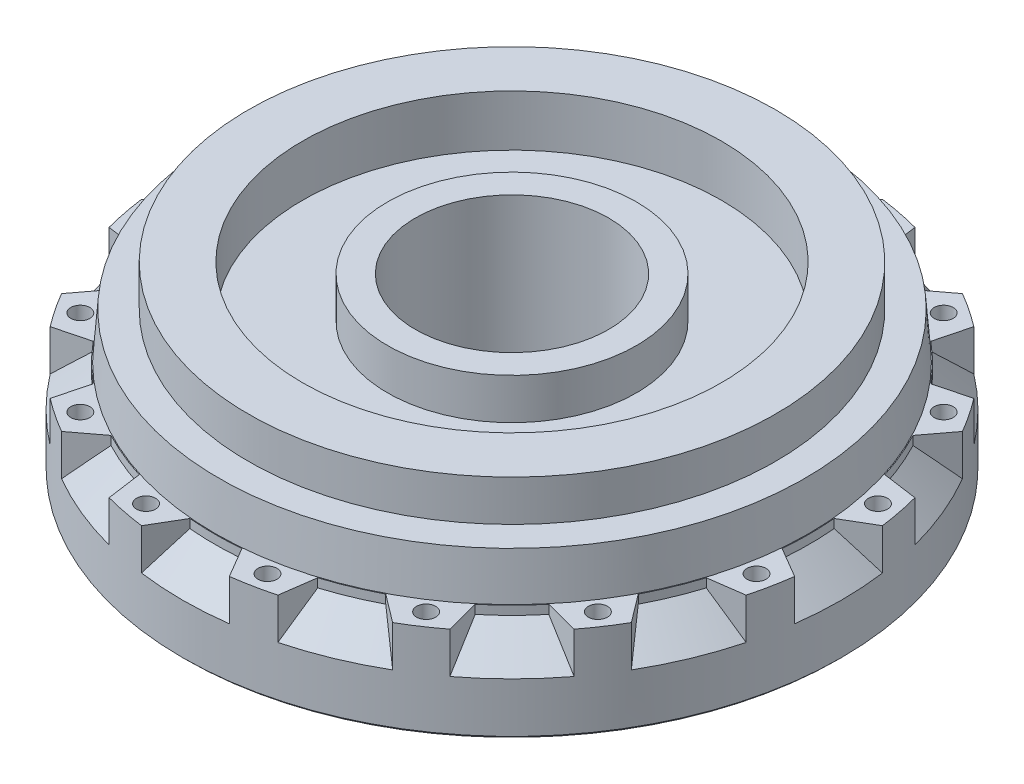
from build123d import *

# Parameters (mm, degrees)
CUT_EXTRUDE1_DEPTH = 28
CIRPATTERN1_COUNT  = 16
SKETCH5_R          = 6.5
CUT_EXTRUDE2_DEPTH = 336.079515181
CHAMFER1_SIZE      = 2


with BuildPart() as part:
    # Sketch1 → Revolve1 (revolve)
    with BuildSketch(Plane.XY, mode=Mode.PRIVATE) as revolve1_sk:
        Polygon((225, 0), (225, 64), (202.5, 64), (200, 95.5), (180, 95.5), (180, 123.5), (143, 123.5), (143, 88.5), (85, 88.5), (85, 116.5), (66, 116.5), (66, -41.015625), (86.5078125, -41.015625), (86.5078125, 0), align=None)
    revolve(revolve1_sk.sketch.rotate(Axis((0, 0, 0), (0, 1, 0)), 90), axis=Axis((0, 0, 0), (0, 1, 0)))

    # Sketch3 → Cut-Extrude1 (cut)
    with BuildSketch(Plane(origin=(0, 64, 0), x_dir=(1, 0, 0), z_dir=(0, 1, 0))):
        with BuildLine():
            Line((222.99103121, 30), (201.742410018, 17.5))
            ThreePointArc((201.742410018, 17.5), (202.5, 0), (201.742410018, -17.5))
            Line((201.742410018, -17.5), (222.99103121, -30))
            ThreePointArc((222.99103121, -30), (225, 0), (222.99103121, 30))
        make_face()
    cut_extrude1 = extrude(amount=-CUT_EXTRUDE1_DEPTH, mode=Mode.SUBTRACT)

    # CirPattern1: Cut-Extrude1 ×16 about axis
    cirpattern1_axis = Axis((0, 0, 0), (0, 1, 0))
    for i in range(1, CIRPATTERN1_COUNT):
        add(cut_extrude1.rotate(cirpattern1_axis, i * 360 / CIRPATTERN1_COUNT), mode=Mode.SUBTRACT)

    # Sketch4 → Revolve2 (revolve)
    with BuildSketch(Plane.XY):
        Polygon((225, 36), (203, 58), (203, 64), (195, 64), (195, 0), (225, 0), align=None)
    revolve(axis=Axis((0, 0, 0), (0, 1, 0)))

    # Sketch5 → Cut-Extrude2 (cut, through all)
    with BuildSketch(Plane(origin=(0, 64, 0), x_dir=(1, 0, 0), z_dir=(0, 1, 0))):
        with Locations(Location((208.416872086, 41.456693428, 0), (0, 0, 270))):
            Circle(SKETCH5_R)
        with Locations(Location((208.416872086, -41.456693428, 0), (0, 0, 270))):
            Circle(SKETCH5_R)
        with Locations(Location((176.687292614, -118.058674517, 0), (0, 0, 270))):
            Circle(SKETCH5_R)
        with Locations(Location((118.058674517, -176.687292614, 0), (0, 0, 270))):
            Circle(SKETCH5_R)
        with Locations(Location((41.456693428, -208.416872086, 0), (0, 0, 270))):
            Circle(SKETCH5_R)
        with Locations(Location((-41.456693428, -208.416872086, 0), (0, 0, 270))):
            Circle(SKETCH5_R)
        with Locations(Location((-118.058674517, -176.687292614, 0), (0, 0, 270))):
            Circle(SKETCH5_R)
        with Locations(Location((-176.687292614, -118.058674517, 0), (0, 0, 270))):
            Circle(SKETCH5_R)
        with Locations(Location((-208.416872086, -41.456693428, 0), (0, 0, 270))):
            Circle(SKETCH5_R)
        with Locations(Location((-208.416872086, 41.456693428, 0), (0, 0, 270))):
            Circle(SKETCH5_R)
        with Locations(Location((-176.687292614, 118.058674517, 0), (0, 0, 270))):
            Circle(SKETCH5_R)
        with Locations(Location((-118.058674517, 176.687292614, 0), (0, 0, 270))):
            Circle(SKETCH5_R)
        with Locations(Location((-41.456693428, 208.416872086, 0), (0, 0, 270))):
            Circle(SKETCH5_R)
        with Locations(Location((41.456693428, 208.416872086, 0), (0, 0, 270))):
            Circle(SKETCH5_R)
        with Locations(Location((118.058674517, 176.687292614, 0), (0, 0, 270))):
            Circle(SKETCH5_R)
        with Locations(Location((176.687292614, 118.058674517, 0), (0, 0, 270))):
            Circle(SKETCH5_R)
    extrude(amount=-CUT_EXTRUDE2_DEPTH, mode=Mode.SUBTRACT)

    # Chamfer1
    chamfer1_edges = [part.edges().sort_by_distance(p)[0] for p in [
        (0, 0, 225),
    ]]
    chamfer(chamfer1_edges, length=CHAMFER1_SIZE)


solid = part.part
